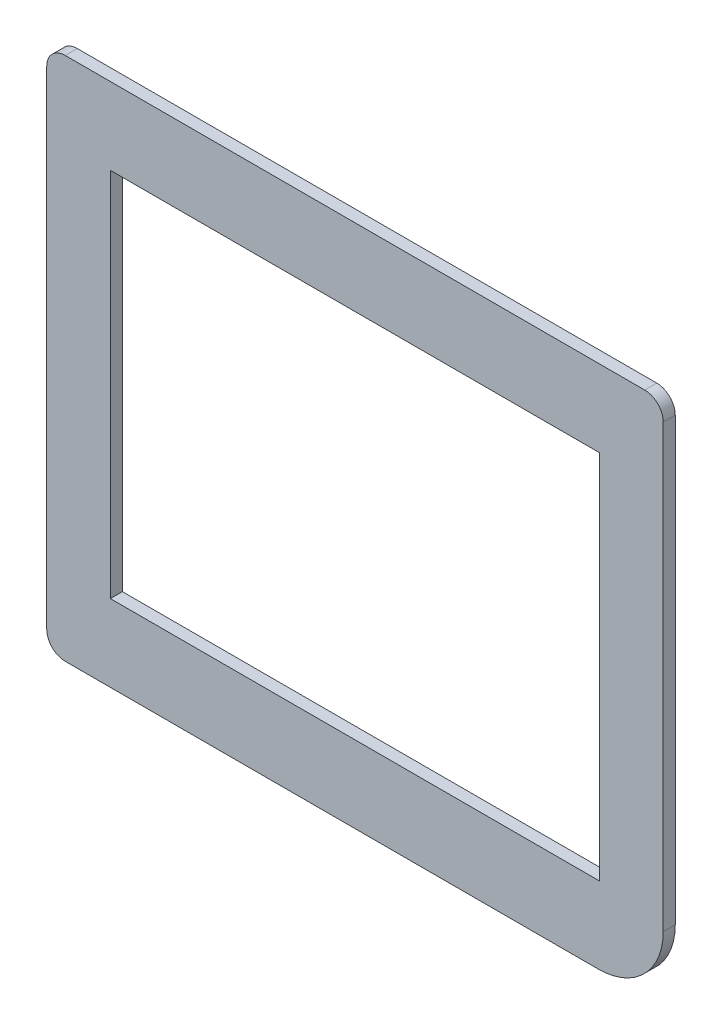
from build123d import *

# Parameters (mm, degrees)
BOSS_EXTRUDE1_DEPTH = 1.3
SKETCH2_W           = 52.88
SKETCH2_H           = 40.08
CUT_EXTRUDE1_DEPTH  = 44.760354203


with BuildPart() as part:
    # Sketch1 → Boss-Extrude1 (new body)
    with BuildSketch(Plane.XY):
        with BuildLine():
            Line((-31.31, 28.35), (31.31, 28.35))
            ThreePointArc((31.31, 28.35), (32.724213562, 27.764213562), (33.31, 26.35))
            Line((33.31, 26.35), (33.31, -21.35))
            ThreePointArc((33.31, -21.35), (31.259747468, -26.299747468), (26.31, -28.35))
            Line((26.31, -28.35), (-31.31, -28.35))
            ThreePointArc((-31.31, -28.35), (-32.724213562, -27.764213562), (-33.31, -26.35))
            Line((-33.31, -26.35), (-33.31, 26.35))
            ThreePointArc((-33.31, 26.35), (-32.724213562, 27.764213562), (-31.31, 28.35))
        make_face()
    extrude(amount=BOSS_EXTRUDE1_DEPTH)

    # Sketch2 → Cut-Extrude1 (cut, through all)
    with BuildSketch(Plane(origin=(0, 0, 0), x_dir=(-1, 0, 0), z_dir=(0, 0, -1))):
        Rectangle(SKETCH2_W, SKETCH2_H)
    extrude(amount=-CUT_EXTRUDE1_DEPTH, mode=Mode.SUBTRACT)


solid = part.part
